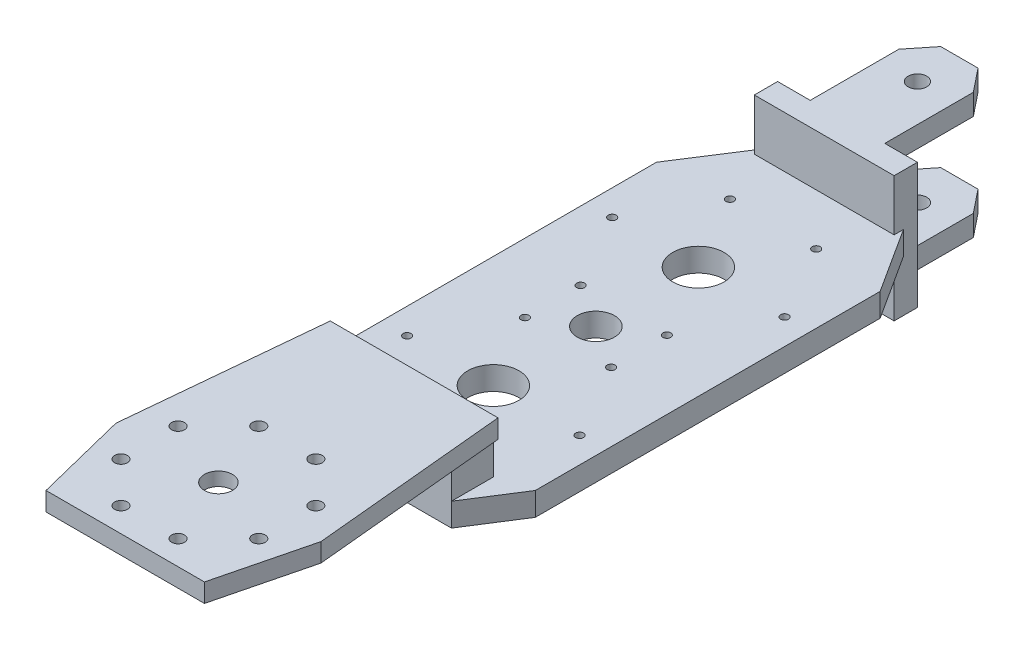
from build123d import *

# Parameters (mm, degrees)
SK_KNEE_PLATE_R         = 2.75
SK_KNEE_PLATE_R_2       = 6
KNEE_PLATE_DEPTH        = 8
SK_KNEE_PILOT_RECESS_R  = 25.15
KNEE_PILOT_RECESS_DEPTH = 2.2
SK_JOGGLE_W             = 68
SK_JOGGLE_H             = 33
JOGGLE_DEPTH            = 18
SK_WEB_R                = 1.7
SK_WEB_R_2              = 11
SK_WEB_R_3              = 8
WEB_DEPTH               = 10
SK_FORK_BAR_W           = 60
SK_FORK_BAR_H           = 54
FORK_BAR_DEPTH          = 10
SK_TINE_LAT_R           = 4
TINE_LAT_DEPTH          = 9
SK_TINE_MED_R           = 4
TINE_MED_DEPTH          = 9


with BuildPart() as part:
    # SK_Knee_Plate → Knee_Plate (new body)
    with BuildSketch(Plane(origin=(0, 20, 0), x_dir=(1, 0, 0), z_dir=(0, 1, 0))):
        Polygon((-34, -40), (34, -40), (44, 0), (36, 84), (-36, 84), (-44, 0), align=None)
        with Locations((29.56414504, 12.245869836)):
            Circle(SK_KNEE_PLATE_R, mode=Mode.SUBTRACT)
        with Locations((12.245869836, 29.56414504)):
            Circle(SK_KNEE_PLATE_R, mode=Mode.SUBTRACT)
        with Locations((-12.245869836, 29.56414504)):
            Circle(SK_KNEE_PLATE_R, mode=Mode.SUBTRACT)
        with Locations((-29.56414504, 12.245869836)):
            Circle(SK_KNEE_PLATE_R, mode=Mode.SUBTRACT)
        with Locations((-29.56414504, -12.245869836)):
            Circle(SK_KNEE_PLATE_R, mode=Mode.SUBTRACT)
        with Locations((-12.245869836, -29.56414504)):
            Circle(SK_KNEE_PLATE_R, mode=Mode.SUBTRACT)
        with Locations((12.245869836, -29.56414504)):
            Circle(SK_KNEE_PLATE_R, mode=Mode.SUBTRACT)
        with Locations((29.56414504, -12.245869836)):
            Circle(SK_KNEE_PLATE_R, mode=Mode.SUBTRACT)
        Circle(SK_KNEE_PLATE_R_2, mode=Mode.SUBTRACT)
    extrude(amount=KNEE_PLATE_DEPTH)

    # SK_Knee_Pilot_Recess → Knee_Pilot_Recess (cut)
    with BuildSketch(Plane(origin=(0, 20, 0), x_dir=(1, 0, 0), z_dir=(0, 1, 0))):
        Circle(SK_KNEE_PILOT_RECESS_R)
    extrude(amount=KNEE_PILOT_RECESS_DEPTH, mode=Mode.SUBTRACT)

    # SK_Joggle → Joggle (add)
    with BuildSketch(Plane.XY.offset(-84)):
        with Locations((0, 11.5)):
            Rectangle(SK_JOGGLE_W, SK_JOGGLE_H)
    extrude(amount=JOGGLE_DEPTH)

    # SK_Web → Web (add)
    with BuildSketch(Plane(origin=(0, -5, 0), x_dir=(1, 0, 0), z_dir=(0, 1, 0))):
        Polygon((-34, 66), (34, 66), (48, 88), (48, 236), (30, 264), (-30, 264), (-48, 236), (-48, 88), align=None)
        with Locations((37, 118)):
            Circle(SK_WEB_R, mode=Mode.SUBTRACT)
        with Locations((18.5, 150.04293994)):
            Circle(SK_WEB_R, mode=Mode.SUBTRACT)
        with Locations((-18.5, 150.04293994)):
            Circle(SK_WEB_R, mode=Mode.SUBTRACT)
        with Locations((-37, 118)):
            Circle(SK_WEB_R, mode=Mode.SUBTRACT)
        with Locations((-18.5, 85.95706006)):
            Circle(SK_WEB_R, mode=Mode.SUBTRACT)
        with Locations((18.5, 85.95706006)):
            Circle(SK_WEB_R, mode=Mode.SUBTRACT)
        with Locations((37, 206)):
            Circle(SK_WEB_R, mode=Mode.SUBTRACT)
        with Locations((18.5, 238.04293994)):
            Circle(SK_WEB_R, mode=Mode.SUBTRACT)
        with Locations((-18.5, 238.04293994)):
            Circle(SK_WEB_R, mode=Mode.SUBTRACT)
        with Locations((-37, 206)):
            Circle(SK_WEB_R, mode=Mode.SUBTRACT)
        with Locations((-18.5, 173.95706006)):
            Circle(SK_WEB_R, mode=Mode.SUBTRACT)
        with Locations((18.5, 173.95706006)):
            Circle(SK_WEB_R, mode=Mode.SUBTRACT)
        with Locations((0, 118)):
            Circle(SK_WEB_R_2, mode=Mode.SUBTRACT)
        with Locations((0, 206)):
            Circle(SK_WEB_R_2, mode=Mode.SUBTRACT)
        with Locations((0, 162)):
            Circle(SK_WEB_R_3, mode=Mode.SUBTRACT)
    extrude(amount=WEB_DEPTH)

    # SK_Fork_Bar → Fork_Bar (add)
    with BuildSketch(Plane.XY.offset(-270)):
        Rectangle(SK_FORK_BAR_W, SK_FORK_BAR_H)
    extrude(amount=FORK_BAR_DEPTH)

    # SK_Tine_Lat → Tine_Lat (add)
    with BuildSketch(Plane(origin=(0, -27, 0), x_dir=(1, 0, 0), z_dir=(0, 1, 0))):
        Polygon((-16, 260), (16, 260), (16, 308), (8, 318), (-8, 318), (-16, 308), align=None)
        with Locations((0, 300)):
            Circle(SK_TINE_LAT_R, mode=Mode.SUBTRACT)
    extrude(amount=TINE_LAT_DEPTH)

    # SK_Tine_Med → Tine_Med (add)
    with BuildSketch(Plane(origin=(0, 18, 0), x_dir=(1, 0, 0), z_dir=(0, 1, 0))):
        Polygon((-16, 260), (16, 260), (16, 308), (8, 318), (-8, 318), (-16, 308), align=None)
        with Locations((0, 300)):
            Circle(SK_TINE_MED_R, mode=Mode.SUBTRACT)
    extrude(amount=TINE_MED_DEPTH)


solid = part.part
